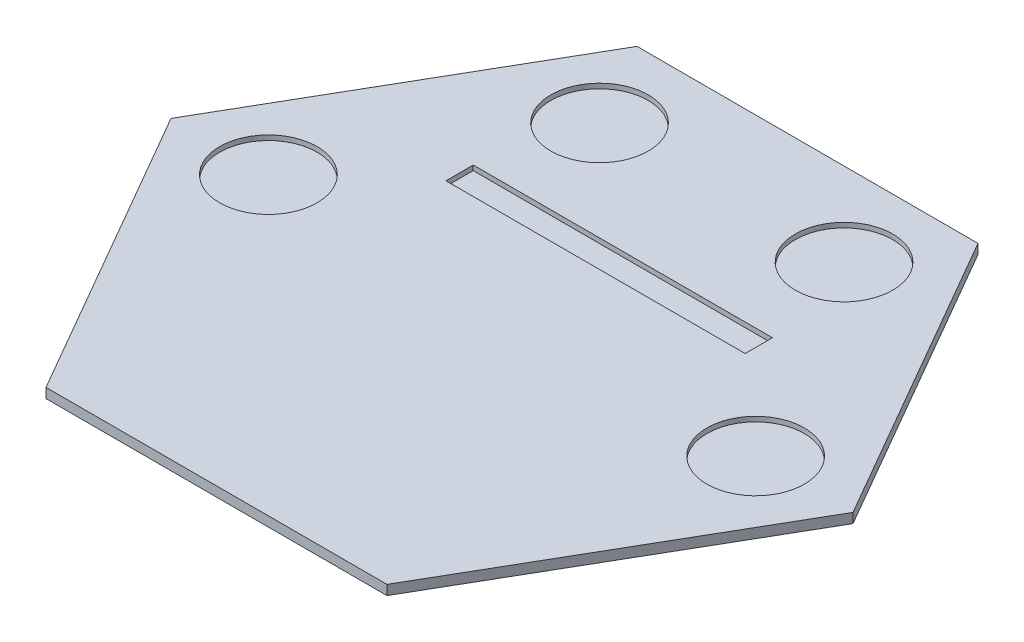
from build123d import *

# Parameters (mm, degrees)
BOSS_EXTRUDE1_DEPTH = 10
SKETCH2_R           = 50
CUT_EXTRUDE2_DEPTH  = 5
SKETCH3_W           = 307
SKETCH3_H           = 28
CUT_EXTRUDE3_DEPTH  = 5


with BuildPart() as part:
    # Sketch1 → Boss-Extrude1 (new body)
    with BuildSketch(Plane(origin=(0, 0, 0), x_dir=(1, 0, 0), z_dir=(0, 1, 0))):
        Polygon((175.101753381, 303.050121206), (-174.898226894, 303.167627278), (-349.999980275, 0.117506072), (-175.101753381, -303.050121206), (174.898226894, -303.167627278), (349.999980275, -0.117506072), align=None)
    extrude(amount=BOSS_EXTRUDE1_DEPTH)

    # Sketch2 → Cut-Extrude2 (cut)
    with BuildSketch(Plane(origin=(0, 10, 0), x_dir=(1, 0, 0), z_dir=(0, 1, 0))):
        with Locations(Location((-250.000009417, 0.041161845, 0), (0, 0, 270))):
            Circle(SKETCH2_R)
        with Locations(Location((-126.076603066, 215.895357646, 0), (0, 0, 270))):
            Circle(SKETCH2_R)
        with Locations(Location((249.999980275, 0, 0), (0, 0, 270))):
            Circle(SKETCH2_R)
        with Locations(Location((122.996764387, 217.697498973, 0), (0, 0, 270))):
            Circle(SKETCH2_R)
    extrude(amount=-CUT_EXTRUDE2_DEPTH, mode=Mode.SUBTRACT)

    # Sketch3 → Cut-Extrude3 (cut)
    with BuildSketch(Plane(origin=(0, 10, 0), x_dir=(1, 0, 0), z_dir=(0, 1, 0))):
        with Locations((0, 99.717508168)):
            Rectangle(SKETCH3_W, SKETCH3_H)
    extrude(amount=-CUT_EXTRUDE3_DEPTH, mode=Mode.SUBTRACT)


solid = part.part
